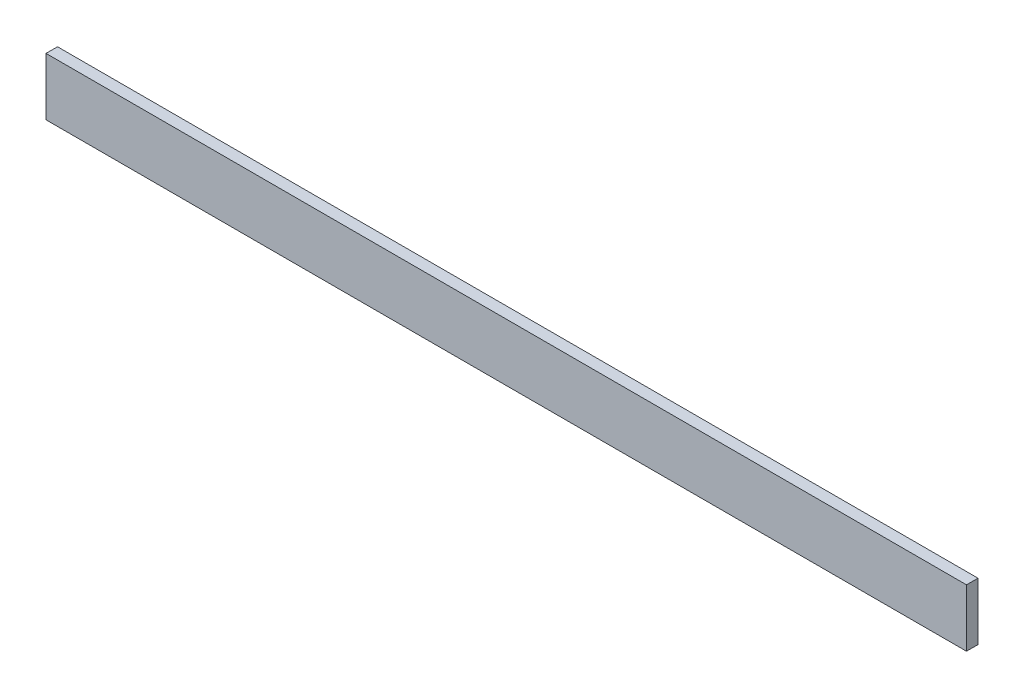
from build123d import *

# Parameters (mm, degrees)
IZIM1_W                     = 800
IZIM1_H                     = 50
Y_KSEKLIK_EKSTR_ZYON1_DEPTH = 10


with BuildPart() as part:
    # Çizim1 → Yükseklik-Ekstrüzyon1 (new body)
    with BuildSketch(Plane.XY):
        Rectangle(IZIM1_W, IZIM1_H)
    extrude(amount=Y_KSEKLIK_EKSTR_ZYON1_DEPTH)


solid = part.part
